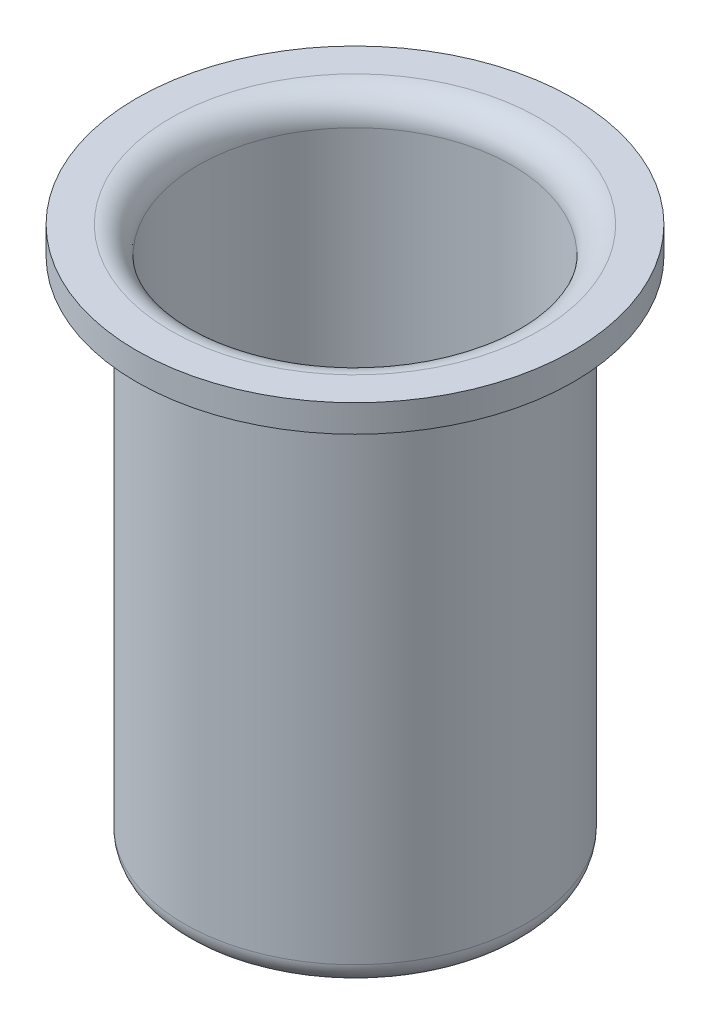
from build123d import *

# Parameters (mm, degrees)
FILLET1_R = 4
FILLET2_R = 8


with BuildPart() as part:
    # Sketch1 → Revolve1 (revolve)
    with BuildSketch(Plane.XY, mode=Mode.PRIVATE) as revolve1_sk:
        with BuildLine():
            Line((50, 151), (50, 6.5))
            ThreePointArc((50, 6.5), (48.096194078, 1.903805922), (43.5, 0))
            Line((43.5, 0), (0, 0))
            Line((0, 0), (0, 4))
            Line((0, 4), (43.5, 4))
            ThreePointArc((43.5, 4), (45.267766953, 4.732233047), (46, 6.5))
            Line((46, 6.5), (46, 159))
            Line((46, 159), (64, 159))
            Line((64, 159), (64, 151))
            Line((64, 151), (50, 151))
        make_face()
    revolve(revolve1_sk.sketch.rotate(Axis((0, 0, 0), (0, 1, 0)), 90), axis=Axis((0, 0, 0), (0, 1, 0)))

    # Fillet1
    fillet1_edges = [part.edges().sort_by_distance(p)[0] for p in [
        (0, 151, 50),
    ]]
    fillet(fillet1_edges, radius=FILLET1_R)

    # Fillet2
    fillet2_edges = [part.edges().sort_by_distance(p)[0] for p in [
        (0, 159, 46),
    ]]
    fillet(fillet2_edges, radius=FILLET2_R)


solid = part.part
